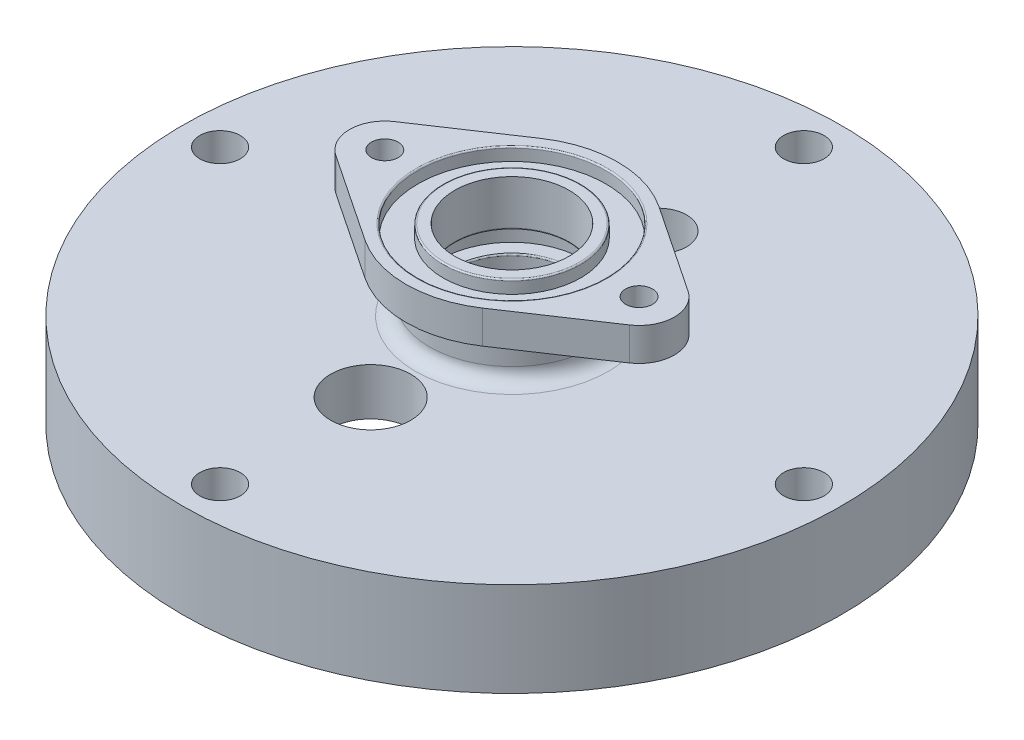
from build123d import *

# Parameters (mm, degrees)
IZIM1_R                     = 70
Y_KSEKLIK_EKSTR_ZYON1_DEPTH = 20
IZIM2_R                     = 50.03
IZIM2_R_2                   = 45
IZIM2_R_3                   = 41
IZIM2_R_4                   = 17.35
KES_EKSTR_ZYON1_DEPTH       = 10
IZIM5_R                     = 17.5
Y_KSEKLIK_EKSTR_ZYON2_DEPTH = 10
IZIM7_R                     = 2.85
Y_KSEKLIK_EKSTR_ZYON3_DEPTH = 7
IZIM8_R                     = 12.15
KES_EKSTR_ZYON3_DEPTH       = 106.683489723
IZIM9_R                     = 19.98
IZIM9_R_2                   = 14.62
KES_EKSTR_ZYON4_DEPTH       = 2.75
RADYUS1_R                   = 0.3
RADYUS2_R                   = 3
IZIM10_W                    = 3.323821642
IZIM10_H                    = 4.5
RADYUS3_R                   = 0.3
IZIM12_R                    = 4.3
KES_EKSTR_ZYON5_DEPTH       = 101.995049384
IZIM13_R                    = 8.5
KES_EKSTR_ZYON6_DEPTH       = 14
IZIM14_R                    = 50.03
IZIM14_R_2                  = 45
KES_EKSTR_ZYON8_DEPTH       = 3
IZIM15_R                    = 5.9
KES_EKSTR_ZYON9_DEPTH       = 10


with BuildPart() as part:
    # Çizim1 → Yükseklik-Ekstrüzyon1 (new body)
    with BuildSketch(Plane(origin=(0, 0, 0), x_dir=(1, 0, 0), z_dir=(0, 1, 0))):
        with Locations(Location((0, 0, 0), (0, 0, 270))):
            Circle(IZIM1_R)
    extrude(amount=Y_KSEKLIK_EKSTR_ZYON1_DEPTH)

    # Çizim2 → Kes-Ekstrüzyon1 (cut)
    # profile 1 of 2: a face of its own
    with BuildSketch(Plane.XZ):
        with Locations(Location((0, 0, 0), (0, 0, 270))):
            Circle(IZIM2_R)
        with Locations(Location((0, 0, 0), (0, 0, 270))):
            Circle(IZIM2_R_2, mode=Mode.SUBTRACT)
    # profile 2 of 2: a face of its own
    with BuildSketch(Plane.XZ):
        with Locations(Location((0, 0, 0), (0, 0, 270))):
            Circle(IZIM2_R_3)
        with Locations(Location((0, 0, 0), (0, 0, 270))):
            Circle(IZIM2_R_4, mode=Mode.SUBTRACT)
    extrude(amount=-KES_EKSTR_ZYON1_DEPTH, mode=Mode.SUBTRACT)

    # Çizim4 → Kes-Döndür1 (revolve, cut)
    with BuildSketch(Plane.XY, mode=Mode.PRIVATE) as kes_d_nd_r1_sk:
        Polygon((-17.35, 10), (-17.35, 0), (-13.6, 0), align=None)
    revolve(kes_d_nd_r1_sk.sketch.rotate(Axis((0, 0, 0), (0, 1, 0)), 270), axis=Axis((0, 0, 0), (0, 1, 0)), mode=Mode.SUBTRACT)

    # Çizim5 → Yükseklik-Ekstrüzyon2 (add)
    with BuildSketch(Plane(origin=(0, 20, 0), x_dir=(1, 0, 0), z_dir=(0, 1, 0))):
        with Locations(Location((0, 0, 0), (0, 0, 270))):
            Circle(IZIM5_R)
    extrude(amount=Y_KSEKLIK_EKSTR_ZYON2_DEPTH)

    # Çizim7 → Yükseklik-Ekstrüzyon3 (add)
    with BuildSketch(Plane(origin=(0, 30, 0), x_dir=(1, 0, 0), z_dir=(0, 1, 0))):
        with BuildLine():
            Line((31.166666667, -6.236095645), (12.5, -18.708286934))
            ThreePointArc((12.5, -18.708286934), (0, -22.5), (-12.5, -18.708286934))
            Line((-12.5, -18.708286934), (-31.166666667, -6.236095645))
            ThreePointArc((-31.166666667, -6.236095645), (-34.5, 0), (-31.166666667, 6.236095645))
            Line((-31.166666667, 6.236095645), (-12.5, 18.708286934))
            ThreePointArc((-12.5, 18.708286934), (0, 22.5), (12.5, 18.708286934))
            Line((12.5, 18.708286934), (31.166666667, 6.236095645))
            ThreePointArc((31.166666667, 6.236095645), (34.5, 0), (31.166666667, -6.236095645))
        make_face()
        with Locations(Location((-27, 0, 0), (0, 0, 270))):
            Circle(IZIM7_R, mode=Mode.SUBTRACT)
        with Locations(Location((27, 0, 0), (0, 0, 270))):
            Circle(IZIM7_R, mode=Mode.SUBTRACT)
    extrude(amount=Y_KSEKLIK_EKSTR_ZYON3_DEPTH)

    # Çizim8 → Kes-Ekstrüzyon3 (cut, through all)
    with BuildSketch(Plane(origin=(0, 37, 0), x_dir=(1, 0, 0), z_dir=(0, 1, 0))):
        with Locations(Location((0, 0, 0), (0, 0, 270))):
            Circle(IZIM8_R)
    extrude(amount=-KES_EKSTR_ZYON3_DEPTH, mode=Mode.SUBTRACT)

    # Çizim9 → Kes-Ekstrüzyon4 (cut)
    with BuildSketch(Plane(origin=(0, 37, 0), x_dir=(1, 0, 0), z_dir=(0, 1, 0))):
        with Locations(Location((0, 0, 0), (0, 0, 270))):
            Circle(IZIM9_R)
        with Locations(Location((0, 0, 0), (0, 0, 270))):
            Circle(IZIM9_R_2, mode=Mode.SUBTRACT)
    extrude(amount=-KES_EKSTR_ZYON4_DEPTH, mode=Mode.SUBTRACT)

    # Radyus1
    radyus1_edges = [part.edges().sort_by_distance(p)[0] for p in [
        (0, 37, -19.98),
        (0, 37, -14.62),
    ]]
    fillet(radyus1_edges, radius=RADYUS1_R)

    # Radyus2
    radyus2_edges = [part.edges().sort_by_distance(p)[0] for p in [
        (0, 20, -17.5),
        (0, 30, -17.5),
    ]]
    fillet(radyus2_edges, radius=RADYUS2_R)

    # Çizim10 → Kes-Döndür2 (revolve, cut)
    with BuildSketch(Plane.XY, mode=Mode.PRIVATE) as kes_d_nd_r2_sk:
        with Locations((-13.578089179, 24.981859074)):
            Rectangle(IZIM10_W, IZIM10_H)
    revolve(kes_d_nd_r2_sk.sketch.rotate(Axis((0, 0, 0), (0, 1, 0)), 90), axis=Axis((0, 0, 0), (0, 1, 0)), mode=Mode.SUBTRACT)

    # Radyus3
    radyus3_edges = [part.edges().sort_by_distance(p)[0] for p in [
        (0, 27.231859074, -12.15),
        (0, 22.731859074, -12.15),
    ]]
    fillet(radyus3_edges, radius=RADYUS3_R)

    # Çizim12 → Kes-Ekstrüzyon5 (cut, through all)
    with BuildSketch(Plane(origin=(0, 20, 0), x_dir=(1, 0, 0), z_dir=(0, 1, 0))):
        with Locations(Location((0, 62, 0), (0, 0, 270))):
            Circle(IZIM12_R)
        with Locations(Location((62, 0, 0), (0, 0, 270))):
            Circle(IZIM12_R)
        with Locations(Location((0, -62, 0), (0, 0, 270))):
            Circle(IZIM12_R)
        with Locations(Location((-62, 0, 0), (0, 0, 270))):
            Circle(IZIM12_R)
    extrude(amount=-KES_EKSTR_ZYON5_DEPTH, mode=Mode.SUBTRACT)

    # Çizim13 → Kes-Ekstrüzyon6 (cut)
    with BuildSketch(Plane.XZ.offset(-10)):
        with Locations(Location((0, 30, 0), (0, 0, 270))):
            Circle(IZIM13_R)
    extrude(amount=-KES_EKSTR_ZYON6_DEPTH, mode=Mode.SUBTRACT)

    # Çizim14 → Kes-Ekstrüzyon8 (cut)
    with BuildSketch(Plane.XZ.offset(-10)):
        with Locations(Location((0, 0, 0), (0, 0, 270))):
            Circle(IZIM14_R)
        with Locations(Location((0, 0, 0), (0, 0, 270))):
            Circle(IZIM14_R_2, mode=Mode.SUBTRACT)
    extrude(amount=-KES_EKSTR_ZYON8_DEPTH, mode=Mode.SUBTRACT)

    # Çizim15 → Kes-Ekstrüzyon9 (cut)
    with BuildSketch(Plane.XZ.offset(-10)):
        with Locations(Location((0, -31.190456297, 0), (0, 0, 270))):
            Circle(IZIM15_R)
    extrude(amount=-KES_EKSTR_ZYON9_DEPTH, mode=Mode.SUBTRACT)


solid = part.part
